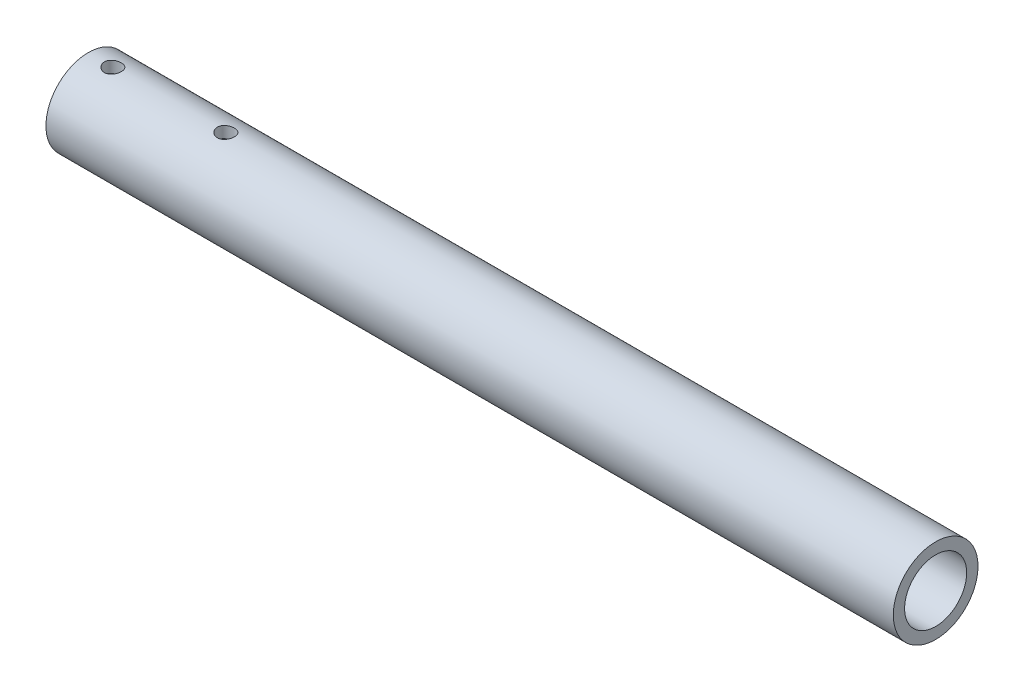
from build123d import *

# Parameters (mm, degrees)
SKETCH_1_R          = 7.498521941
SKETCH_1_R_2        = 5.496326061
EXTRUDE_1_DEPTH     = 150
SKETCH_2_R          = 1.5
CUT_EXTRUDE_1_DEPTH = 14


with BuildPart() as part:
    # 草图1 → 凸台-拉伸1 (new body)
    with BuildSketch(Plane(origin=(0, 0, 0), x_dir=(0, 0, -1), z_dir=(1, 0, 0))):
        Circle(SKETCH_1_R)
        Circle(SKETCH_1_R_2, mode=Mode.SUBTRACT)
    extrude(amount=EXTRUDE_1_DEPTH)

    # 草图2 → 切除-拉伸1 (cut, symmetric)
    with BuildSketch(Plane(origin=(0, 0, 0), x_dir=(1, 0, 0), z_dir=(0, 1, 0))):
        with Locations(Location((4.36, 0, 0), (0, 0, 270))):
            Circle(SKETCH_2_R)
        with Locations(Location((24.36, 0, 0), (0, 0, 270))):
            Circle(SKETCH_2_R)
    extrude(amount=CUT_EXTRUDE_1_DEPTH, both=True, mode=Mode.SUBTRACT)


solid = part.part
